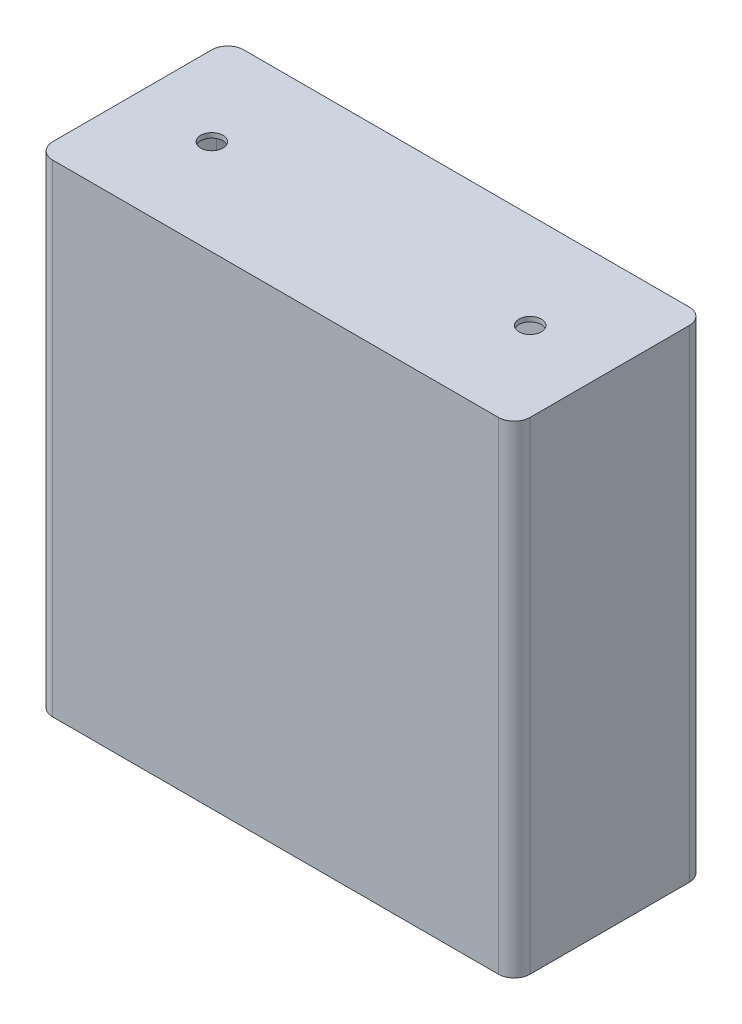
from build123d import *

# Parameters (mm, degrees)
BOSS_EXTRUDE1_DEPTH     = 300
SHELL5_T                = -3
BOSS_EXTRUDE2_DEPTH     = 3
CUT_EXTRUDE1_DEPTH      = 443.954850972
CUT_EXTRUDE1_DEPTH_BACK = 443.954850972
SKETCH4_R               = 7


with BuildPart() as part:
    # Sketch2 → Boss-Extrude1 (new body)
    with BuildSketch(Plane(origin=(0, 0, 0), x_dir=(1, 0, 0), z_dir=(0, 1, 0))):
        with BuildLine():
            Line((10, 0), (290, 0))
            ThreePointArc((290, 0), (297.071067812, 2.928932188), (300, 10))
            Line((300, 10), (300, 110))
            ThreePointArc((300, 110), (297.071067812, 117.071067812), (290, 120))
            Line((290, 120), (10, 120))
            ThreePointArc((10, 120), (2.928932188, 117.071067812), (0, 110))
            Line((0, 110), (0, 10))
            ThreePointArc((0, 10), (2.928932188, 2.928932188), (10, 0))
        make_face()
    extrude(amount=BOSS_EXTRUDE1_DEPTH)

    # Shell5
    shell5_openings = [part.faces().sort_by_distance(p)[0] for p in [
        (150, 300, -60),
    ]]
    offset(amount=SHELL5_T, openings=shell5_openings, kind=Kind.INTERSECTION)

    # Sketch3 → Boss-Extrude2 (add)
    with BuildSketch(Plane(origin=(0, 300, 0), x_dir=(1, 0, 0), z_dir=(0, 1, 0))):
        with BuildLine():
            Line((10, 0), (290, 0))
            ThreePointArc((290, 0), (297.071067812, 2.928932188), (300, 10))
            Line((300, 10), (300, 110))
            ThreePointArc((300, 110), (297.071067812, 117.071067812), (290, 120))
            Line((290, 120), (10, 120))
            ThreePointArc((10, 120), (2.928932188, 117.071067812), (0, 110))
            Line((0, 110), (0, 10))
            ThreePointArc((0, 10), (2.928932188, 2.928932188), (10, 0))
        make_face()
    extrude(amount=BOSS_EXTRUDE2_DEPTH)

    # Sketch4 → Cut-Extrude1 (cut, two sides: drawn at the far end of the back side and taken through both)
    with BuildSketch(Plane(origin=(0, 303, 0), x_dir=(1, 0, 0), z_dir=(0, 1, 0)).offset(-CUT_EXTRUDE1_DEPTH_BACK)):
        with Locations(Location((50, 60, 0), (0, 0, 270))):
            Circle(SKETCH4_R)
        with Locations(Location((250, 60, 0), (0, 0, 270))):
            Circle(SKETCH4_R)
    extrude(amount=CUT_EXTRUDE1_DEPTH + CUT_EXTRUDE1_DEPTH_BACK, mode=Mode.SUBTRACT)


solid = part.part
